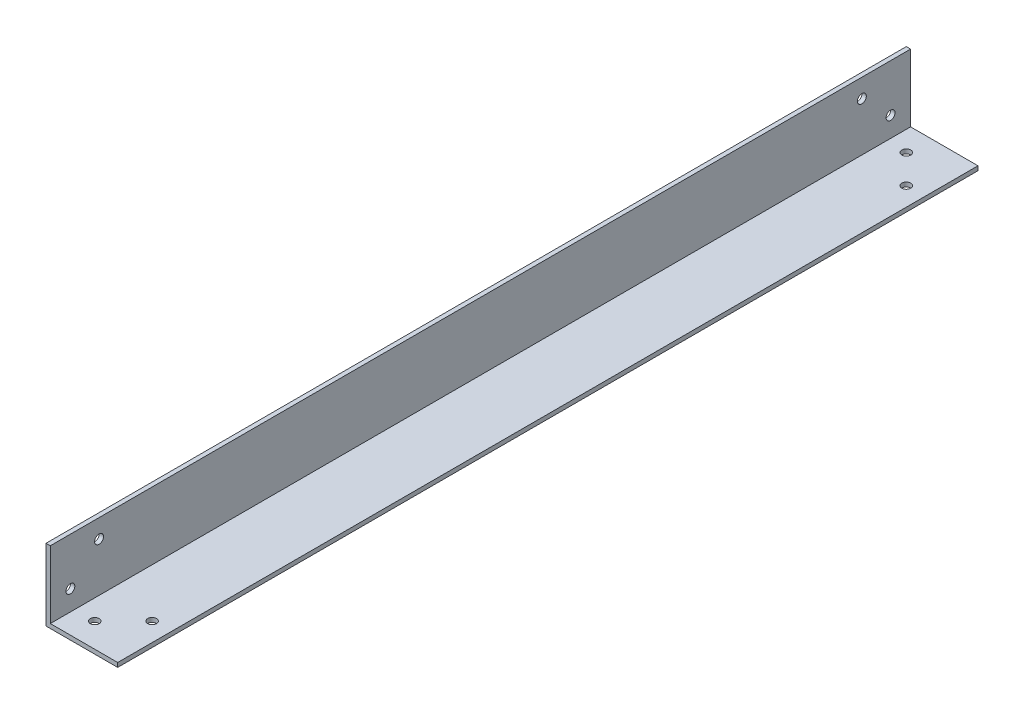
from build123d import *

# Parameters (mm, degrees)
BOSS_EXTRUDE1_DEPTH = 300
SKETCH2_R           = 1.55
CUT_EXTRUDE1_DEPTH  = 10
SKETCH3_R           = 1.55
CUT_EXTRUDE2_DEPTH  = 10


with BuildPart() as part:
    # Sketch1 → Boss-Extrude1 (new body)
    with BuildSketch(Plane.XY):
        Polygon((0, 0), (0, 25), (1.5, 25), (1.5, 1.5), (25, 1.5), (25, 0), align=None)
    extrude(amount=BOSS_EXTRUDE1_DEPTH)

    # Sketch2 → Cut-Extrude1 (cut)
    with BuildSketch(Plane.ZY):
        with Locations((283, 18.5)):
            Circle(SKETCH2_R)
        with Locations((293, 8.5)):
            Circle(SKETCH2_R)
        with Locations((17, 18.5)):
            Circle(SKETCH2_R)
        with Locations((7, 8.5)):
            Circle(SKETCH2_R)
    extrude(amount=-CUT_EXTRUDE1_DEPTH, mode=Mode.SUBTRACT)

    # Sketch3 → Cut-Extrude2 (cut)
    with BuildSketch(Plane.XZ):
        with Locations((18.5, 281.5)):
            Circle(SKETCH3_R)
        with Locations((8.5, 291.5)):
            Circle(SKETCH3_R)
        with Locations((18.5, 18.5)):
            Circle(SKETCH3_R)
        with Locations((8.5, 8.5)):
            Circle(SKETCH3_R)
    extrude(amount=-CUT_EXTRUDE2_DEPTH, mode=Mode.SUBTRACT)


solid = part.part
